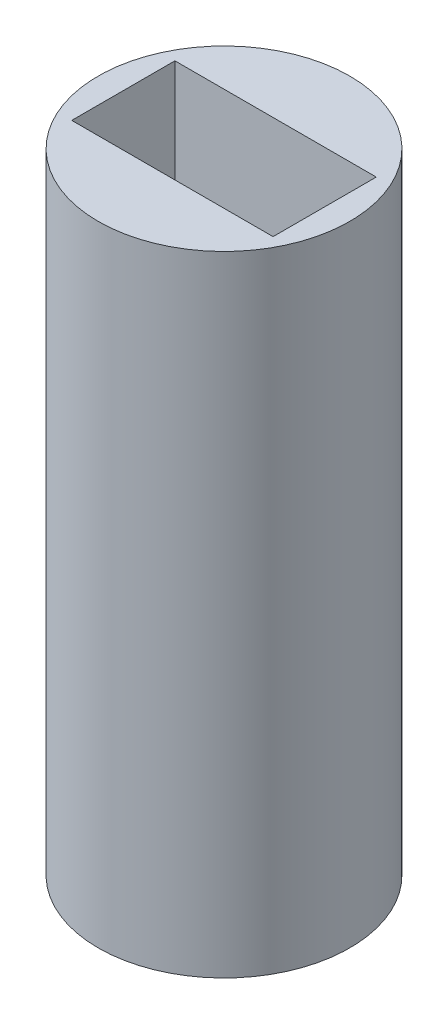
from build123d import *

# Parameters (mm, degrees)
SKETCH1_R           = 5
BOSS_EXTRUDE1_DEPTH = 25
CUT_EXTRUDE1_DEPTH  = 2.05


with BuildPart() as part:
    # Sketch1 → Boss-Extrude1 (new body)
    with BuildSketch(Plane(origin=(0, 0, 0), x_dir=(1, 0, 0), z_dir=(0, 1, 0))):
        with Locations(Location((0, 0, 0), (0, 0, 270))):
            Circle(SKETCH1_R)
    extrude(amount=BOSS_EXTRUDE1_DEPTH)

    # Sketch2 → Cut-Extrude1 (cut, symmetric)
    with BuildSketch(Plane.XY):
        with BuildLine():
            Line((-4, 11.5), (-4, 25))
            Line((-4, 25), (4, 25))
            Line((4, 25), (4, 11.5))
            ThreePointArc((4, 11.5), (0, 7.5), (-4, 11.5))
        make_face()
    extrude(amount=CUT_EXTRUDE1_DEPTH, both=True, mode=Mode.SUBTRACT)


solid = part.part
